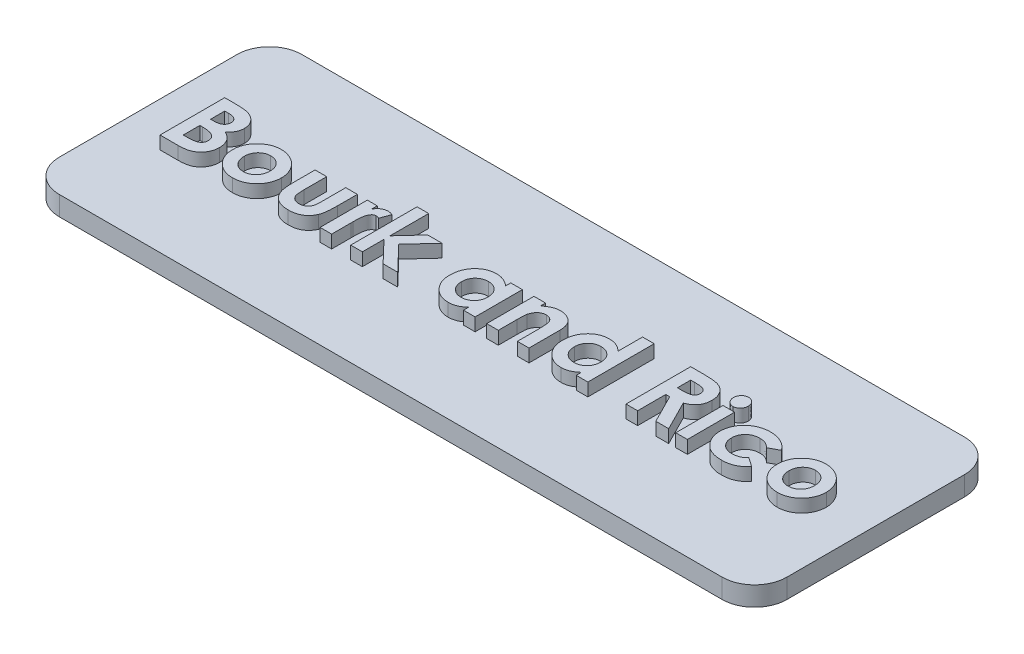
from build123d import *

# Parameters (mm, degrees)
SKETCH1_W           = 45
SKETCH1_H           = 15
BOSS_EXTRUDE1_DEPTH = 1.2
SKETCH2_W           = 0.717948718
SKETCH2_H           = 2.923076923
BOSS_EXTRUDE2_DEPTH = 0.8
FILLET1_R           = 2


with BuildPart() as part:
    # Sketch1 → Boss-Extrude1 (new body)
    with BuildSketch(Plane(origin=(0, 0, 0), x_dir=(1, 0, 0), z_dir=(0, 1, 0))):
        with Locations((22.5, 0)):
            Rectangle(SKETCH1_W, SKETCH1_H)
    extrude(amount=BOSS_EXTRUDE1_DEPTH)

    # Sketch2 → Boss-Extrude2 (add)
    # profile 1 of 13: a face of its own
    with BuildSketch(Plane(origin=(0, 1.2, 0), x_dir=(1, 0, 0), z_dir=(0, 1, 0))):
        with BuildLine():
            Line((2.730769231, -2), (2.730769231, 2))
            Line((2.730769231, 2), (3.371794872, 2))
            add(Edge.make_bspline(
                [(3.371794872, 2), (3.416670675, 2.000005121), (3.503504503, 2.000015031), (3.628783055, 1.99561566), (3.744968332, 1.98992458), (3.851690588, 1.983557585), (3.94913147, 1.972585981), (4.037142805, 1.961023108), (4.115900439, 1.947078997), (4.164592005, 1.934570697), (4.1875, 1.928685897)],
                knots=[0, 0, 0, 0, 1.311965854, 2.538629056, 3.664479157, 4.713267157, 5.663616078, 6.530575999, 7.308677837, 8, 8, 8, 8], degree=3))
            add(Edge.make_bspline(
                [(4.1875, 1.928685897), (4.217580524, 1.920385283), (4.276608168, 1.904096814), (4.361154593, 1.871201546), (4.441358669, 1.834636124), (4.517122472, 1.792921815), (4.58798078, 1.745555013), (4.653664309, 1.692159799), (4.715589689, 1.634879455), (4.771558091, 1.572117594), (4.822144305, 1.505798061), (4.866094655, 1.435938236), (4.904281877, 1.363606319), (4.934841656, 1.287892062), (4.957867876, 1.209144149), (4.974709157, 1.127698846), (4.985624588, 1.04329844), (4.986655953, 0.985878085), (4.987179487, 0.956730769)],
                knots=[0, 0, 0, 0, 1.099996261, 2.158545794, 3.195537121, 4.207578794, 5.205712374, 6.197378256, 7.190519799, 8.17788031, 9.159561366, 10.129234751, 11.085776129, 12.040971148, 13.00380137, 13.975669004, 14.972423361, 16, 16, 16, 16], degree=3))
            add(Edge.make_bspline(
                [(4.987179487, 0.956730769), (4.985810601, 0.919284119), (4.983116116, 0.845574989), (4.965903562, 0.737309612), (4.933627343, 0.63498327), (4.891394695, 0.536710127), (4.833971497, 0.442856741), (4.761055142, 0.353467738), (4.673826636, 0.265790696), (4.606917556, 0.213234224), (4.572115385, 0.185897436)],
                knots=[0, 0, 0, 0, 0.986156485, 1.941127874, 2.875419072, 3.804401753, 4.751181392, 5.761612777, 6.835722519, 8, 8, 8, 8], degree=3))
            add(Edge.make_bspline(
                [(4.572115385, 0.185897436), (4.600317394, 0.171500554), (4.655613733, 0.143272253), (4.734118289, 0.096873352), (4.806804938, 0.047522237), (4.873999586, -0.00378813), (4.934292747, -0.059232867), (4.990174028, -0.115617174), (5.038886536, -0.176171636), (5.082446729, -0.238737978), (5.12030854, -0.304222167), (5.153282003, -0.372513615), (5.181133505, -0.443845621), (5.204718876, -0.517855162), (5.222308853, -0.594796797), (5.233777892, -0.674698043), (5.242559304, -0.757286397), (5.243242416, -0.813543521), (5.243589744, -0.842147436)],
                knots=[0, 0, 0, 0, 1.164658916, 2.283573913, 3.35186032, 4.395461096, 5.390182219, 6.362969632, 7.312859996, 8.245001507, 9.165155236, 10.092416118, 11.032087915, 11.979892451, 12.947605196, 13.931445124, 14.948243989, 16, 16, 16, 16], degree=3))
            add(Edge.make_bspline(
                [(5.243589744, -0.842147436), (5.241335819, -0.896779278), (5.236887707, -1.004595001), (5.204365283, -1.162893242), (5.147981734, -1.312974333), (5.072270255, -1.454241786), (4.978979145, -1.582606141), (4.871721122, -1.695052202), (4.751576027, -1.790235296), (4.640727656, -1.8544765), (4.544852544, -1.897588356), (4.46544098, -1.924242823), (4.380154644, -1.948935482), (4.287431294, -1.966275177), (4.18895188, -1.982146372), (4.083756219, -1.991945577), (3.972040921, -1.998586256), (3.895310025, -1.999519225), (3.855769231, -2)],
                knots=[0, 0, 0, 0, 1.284142165, 2.534249414, 3.780121997, 5.041676246, 6.291546858, 7.49970053, 8.684500223, 9.883330709, 10.50184324, 11.153274765, 11.851151195, 12.587658647, 13.369265475, 14.195992086, 15.070362669, 16, 16, 16, 16], degree=3))
            Line((3.855769231, -2), (2.730769231, -2))
        make_face()
        with BuildLine():
            Line((3.448717949, 1.282051282), (3.448717949, 0.41025641))
            Line((3.448717949, 0.41025641), (3.639423077, 0.41025641))
            add(Edge.make_bspline(
                [(3.639423077, 0.41025641), (3.665341617, 0.41048243), (3.715375791, 0.410918747), (3.787644847, 0.416538357), (3.854843399, 0.426125762), (3.916716576, 0.439502603), (3.973840749, 0.456489241), (4.025850993, 0.476927824), (4.072518629, 0.501865118), (4.126735627, 0.539010317), (4.184046905, 0.593671141), (4.234497378, 0.672640026), (4.26421237, 0.763453943), (4.267521818, 0.827502949), (4.269230769, 0.860576923)],
                knots=[0, 0, 0, 0, 1.065314748, 2.056525647, 2.977365736, 3.853934255, 4.656397591, 5.425096493, 6.14721249, 6.826394842, 8.123232004, 9.372140726, 10.643011755, 12, 12, 12, 12], degree=3))
            add(Edge.make_bspline(
                [(4.269230769, 0.860576923), (4.267863296, 0.891556195), (4.26521934, 0.951453371), (4.235300164, 1.035554342), (4.188829768, 1.110085014), (4.133964935, 1.161095164), (4.082299033, 1.195933593), (4.038059518, 1.218873214), (3.989503327, 1.239408529), (3.935690466, 1.255110331), (3.876928236, 1.266892411), (3.813502076, 1.275544937), (3.745302557, 1.281434215), (3.698197003, 1.281841181), (3.673878205, 1.282051282)],
                knots=[0, 0, 0, 0, 1.347982417, 2.606269829, 3.849316587, 5.153353503, 5.842674298, 6.568177932, 7.326619318, 8.142485038, 9.012069166, 9.942760135, 10.937925643, 12, 12, 12, 12], degree=3))
            Line((3.673878205, 1.282051282), (3.448717949, 1.282051282))
        make_face(mode=Mode.SUBTRACT)
        with BuildLine():
            Line((3.448717949, -0.256410256), (3.448717949, -1.282051282))
            Line((3.448717949, -1.282051282), (3.655448718, -1.282051282))
            add(Edge.make_bspline(
                [(3.655448718, -1.282051282), (3.696319654, -1.281817788), (3.774899129, -1.281368866), (3.887464088, -1.275944826), (3.989813777, -1.266168948), (4.081677008, -1.253964552), (4.163194486, -1.237429504), (4.234090664, -1.216407311), (4.295337791, -1.193279236), (4.346568625, -1.164713318), (4.388421281, -1.131469672), (4.426188916, -1.097493869), (4.456982291, -1.058299569), (4.481346585, -1.015569276), (4.502433838, -0.970364441), (4.51515218, -0.920919832), (4.524835479, -0.868700869), (4.525368377, -0.832582141), (4.525641026, -0.814102564)],
                knots=[0, 0, 0, 0, 1.753078804, 3.370512758, 4.83203934, 6.162291463, 7.344201807, 8.395507345, 9.331626367, 10.147333109, 10.898971645, 11.62040215, 12.321813352, 13.025280112, 13.727906689, 14.453419512, 15.208716525, 16, 16, 16, 16], degree=3))
            add(Edge.make_bspline(
                [(4.525641026, -0.814102564), (4.525039757, -0.792970878), (4.523868647, -0.751812037), (4.514304178, -0.691653999), (4.496922415, -0.635492479), (4.475029235, -0.581891351), (4.444563712, -0.532769723), (4.40835648, -0.48642768), (4.3646089, -0.444434508), (4.315412194, -0.404250303), (4.258029107, -0.369066854), (4.192432718, -0.338538981), (4.118266669, -0.313043224), (4.035301225, -0.292743487), (3.943900099, -0.27551538), (3.843396164, -0.265228298), (3.734626451, -0.257577344), (3.659203762, -0.256808125), (3.620192308, -0.256410256)],
                knots=[0, 0, 0, 0, 0.845221588, 1.646264278, 2.427170338, 3.19324141, 3.95557735, 4.731569926, 5.540061037, 6.376114724, 7.268642756, 8.224665384, 9.265483498, 10.400594375, 11.639216012, 12.983232105, 14.439614077, 16, 16, 16, 16], degree=3))
            Line((3.620192308, -0.256410256), (3.448717949, -0.256410256))
        make_face(mode=Mode.SUBTRACT)
    # profile 2 of 13: a face of its own
    with BuildSketch(Plane(origin=(0, 1.2, 0), x_dir=(1, 0, 0), z_dir=(0, 1, 0))):
        with BuildLine():
            add(Edge.make_bspline(
                [(7.251602564, 0.974358974), (7.285545793, 0.973754931), (7.352768768, 0.972558653), (7.452888991, 0.962600724), (7.551258881, 0.946353952), (7.648443856, 0.925317219), (7.743541463, 0.89584161), (7.837050476, 0.860490174), (7.929806986, 0.819902591), (8.019508793, 0.771589171), (8.106803928, 0.719188861), (8.18956491, 0.66138702), (8.267104468, 0.598637661), (8.340862, 0.532395677), (8.407400284, 0.45977711), (8.470971476, 0.384281025), (8.528140978, 0.303202662), (8.581071702, 0.218517714), (8.628195545, 0.130715895), (8.669113936, 0.040407988), (8.704627252, -0.051157438), (8.732433466, -0.145095711), (8.755454449, -0.240168131), (8.769982326, -0.337539739), (8.780310639, -0.436210284), (8.78146877, -0.502643415), (8.782051282, -0.536057692)],
                knots=[0, 0, 0, 0, 1.022364134, 2.024744242, 3.027414945, 4.024939316, 5.017584196, 6.023349371, 7.035562955, 8.064994934, 9.090267829, 10.101425541, 11.102933353, 12.093946398, 13.084502048, 14.067315274, 15.065326281, 16.070028806, 17.074376865, 18.064572984, 19.055292013, 20.030201733, 21.013838017, 21.999348303, 22.993720005, 24, 24, 24, 24], degree=3))
            add(Edge.make_bspline(
                [(8.782051282, -0.536057692), (8.781436537, -0.569733019), (8.780214284, -0.636687201), (8.770355991, -0.736285865), (8.754047032, -0.834115367), (8.732929559, -0.930752036), (8.703564256, -1.024959315), (8.669254033, -1.118125856), (8.627136885, -1.208981763), (8.580573275, -1.29851819), (8.527302229, -1.384100353), (8.470182213, -1.465990926), (8.406877289, -1.542041533), (8.340871661, -1.614610716), (8.269034534, -1.681244511), (8.192512563, -1.743024871), (8.111968215, -1.80070709), (8.02682229, -1.852937834), (7.938165368, -1.898831126), (7.847492629, -1.940207674), (7.75427387, -1.974656605), (7.658702012, -2.002748759), (7.560719094, -2.024499811), (7.460541438, -2.03927556), (7.358384788, -2.049551922), (7.28955566, -2.050701629), (7.254807692, -2.051282051)],
                knots=[0, 0, 0, 0, 1.012026251, 2.012137606, 3.004615893, 3.992048833, 4.982446996, 5.968083444, 6.973977695, 7.990229942, 8.999482246, 10.001782172, 10.988562221, 11.971415814, 12.948383116, 13.930088534, 14.925840678, 15.924049238, 16.929462851, 17.924729459, 18.917889337, 19.913673841, 20.916777188, 21.931792057, 22.95587778, 24, 24, 24, 24], degree=3))
            add(Edge.make_bspline(
                [(7.254807692, -2.051282051), (7.203999079, -2.049790718), (7.103854527, -2.046851278), (6.95636528, -2.026716883), (6.8146768, -1.99206031), (6.678558208, -1.943749811), (6.547832683, -1.881841706), (6.423641092, -1.805221026), (6.304748068, -1.715396212), (6.193212927, -1.61312647), (6.091031629, -1.500927303), (6.001763971, -1.381155375), (5.925968505, -1.255605867), (5.863713425, -1.12413561), (5.815665198, -0.986564323), (5.78096618, -0.843303296), (5.760807168, -0.693949843), (5.757892589, -0.592474798), (5.756410256, -0.540865385)],
                knots=[0, 0, 0, 0, 1.029999031, 2.030143771, 3.011211297, 3.982305373, 4.953580601, 5.938004764, 6.935448627, 7.970290061, 9.001484052, 10.007591832, 10.993831261, 11.969999897, 12.951306496, 13.942897864, 14.953773953, 16, 16, 16, 16], degree=3))
            add(Edge.make_bspline(
                [(5.756410256, -0.540865385), (5.757944282, -0.485757844), (5.760959379, -0.377445077), (5.784900573, -0.218764406), (5.823132077, -0.066835183), (5.878010993, 0.077917598), (5.948113982, 0.215760912), (6.033693844, 0.346404033), (6.13517352, 0.469876554), (6.212886631, 0.544556967), (6.252403846, 0.582532051)],
                knots=[0, 0, 0, 0, 1.043912699, 2.05178951, 3.033892, 4.007821512, 4.978932272, 5.95884105, 6.962068106, 8, 8, 8, 8], degree=3))
            add(Edge.make_bspline(
                [(6.252403846, 0.582532051), (6.288664841, 0.614009125), (6.360200277, 0.676106874), (6.476421816, 0.754867689), (6.595419558, 0.822893004), (6.718619741, 0.878822465), (6.846365816, 0.920992377), (6.978003157, 0.951688299), (7.113504392, 0.970542634), (7.205335907, 0.973080396), (7.251602564, 0.974358974)],
                knots=[0, 0, 0, 0, 1.048115528, 2.067714963, 3.060638214, 4.039924844, 5.017819947, 5.994373833, 6.98952318, 8, 8, 8, 8], degree=3))
        make_face()
        with BuildLine():
            add(Edge.make_bspline(
                [(7.267628205, 0.307692308), (7.239831201, 0.306768427), (7.185112499, 0.304949759), (7.104565132, 0.295189451), (7.028382584, 0.275184863), (6.955051728, 0.249744501), (6.885869794, 0.215721601), (6.818942134, 0.175906968), (6.757748841, 0.126083854), (6.699328574, 0.071431543), (6.646295994, 0.010741618), (6.6011072, -0.055380009), (6.560730011, -0.124403665), (6.530114036, -0.19885639), (6.504776391, -0.276703177), (6.487628176, -0.359201791), (6.475694216, -0.44543068), (6.474808288, -0.504498059), (6.474358974, -0.534455128)],
                knots=[0, 0, 0, 0, 1.030650113, 2.02884584, 2.99876339, 3.944280128, 4.900564847, 5.851248946, 6.823638398, 7.81794922, 8.81432732, 9.802856497, 10.78262424, 11.771747962, 12.779760563, 13.812642396, 14.89064281, 16, 16, 16, 16], degree=3))
            add(Edge.make_bspline(
                [(6.474358974, -0.534455128), (6.474884733, -0.565468634), (6.475912226, -0.626078575), (6.486552137, -0.71457724), (6.504097701, -0.798561887), (6.529024448, -0.877902776), (6.560374042, -0.953169409), (6.598836358, -1.023939487), (6.644817323, -1.089787498), (6.696948577, -1.150632354), (6.754030074, -1.205861904), (6.816575515, -1.253257836), (6.881965734, -1.294438611), (6.951707676, -1.32751313), (7.024810805, -1.353049342), (7.101492135, -1.371850795), (7.182154625, -1.381980107), (7.237153695, -1.38372488), (7.265224359, -1.384615385)],
                knots=[0, 0, 0, 0, 1.141730614, 2.231293227, 3.276944405, 4.297399982, 5.28939179, 6.275415646, 7.257752684, 8.24146775, 9.222424823, 10.176631434, 11.126518621, 12.063689483, 13.012557477, 13.974037417, 14.965980454, 16, 16, 16, 16], degree=3))
            add(Edge.make_bspline(
                [(7.265224359, -1.384615385), (7.293309062, -1.383825547), (7.348371384, -1.382277007), (7.429128597, -1.37068089), (7.506201518, -1.352430887), (7.579929005, -1.326674894), (7.649714964, -1.292892433), (7.715826544, -1.251514643), (7.778845334, -1.203459476), (7.83669287, -1.147187849), (7.890241228, -1.08615324), (7.937199935, -1.019957622), (7.976440402, -0.949187526), (8.008624611, -0.874288237), (8.033600223, -0.795362705), (8.050855316, -0.712117573), (8.062795657, -0.624810823), (8.063661548, -0.564945658), (8.064102564, -0.534455128)],
                knots=[0, 0, 0, 0, 1.031504075, 2.022346795, 2.991027682, 3.937587355, 4.885570121, 5.833146507, 6.798790848, 7.791235734, 8.792807298, 9.778388351, 10.766749885, 11.760164525, 12.768777521, 13.802286646, 14.880660483, 16, 16, 16, 16], degree=3))
            add(Edge.make_bspline(
                [(8.064102564, -0.534455128), (8.063570118, -0.503975255), (8.062525285, -0.444163855), (8.051884616, -0.356739025), (8.034511239, -0.273762964), (8.009262992, -0.195589974), (7.978099736, -0.121328225), (7.939610835, -0.051357835), (7.893403106, 0.013976574), (7.841018427, 0.074351038), (7.783081243, 0.128805591), (7.721621741, 0.177365834), (7.655234531, 0.217528885), (7.585165078, 0.250637576), (7.511226959, 0.276109988), (7.433503183, 0.295017995), (7.351755551, 0.305003171), (7.295963731, 0.306786561), (7.267628205, 0.307692308)],
                knots=[0, 0, 0, 0, 1.123894411, 2.205445421, 3.243160173, 4.246488011, 5.231014757, 6.210004299, 7.185865357, 8.177612767, 9.153374344, 10.115157457, 11.061423229, 12.009021698, 12.96873347, 13.94135618, 14.954456845, 16, 16, 16, 16], degree=3))
        make_face(mode=Mode.SUBTRACT)
    # profile 3 of 13: a face of its own
    with BuildSketch(Plane(origin=(0, 1.2, 0), x_dir=(1, 0, 0), z_dir=(0, 1, 0))):
        with BuildLine():
            Line((9.397435897, 0.923076923), (10.115384615, 0.923076923))
            Line((10.115384615, 0.923076923), (10.115384615, -0.479967949))
            add(Edge.make_bspline(
                [(10.115384615, -0.479967949), (10.11544837, -0.512823873), (10.11557073, -0.575882415), (10.118975607, -0.666446827), (10.123753322, -0.749263835), (10.129715588, -0.824431095), (10.138614652, -0.891767805), (10.148888247, -0.951145416), (10.160535188, -1.002991753), (10.179474586, -1.060781408), (10.209105616, -1.124021071), (10.253853717, -1.191157399), (10.308056718, -1.249210693), (10.370982301, -1.298696144), (10.443273091, -1.337691767), (10.52393311, -1.364118505), (10.61194749, -1.381880021), (10.673249374, -1.383679567), (10.705128205, -1.384615385)],
                knots=[0, 0, 0, 0, 1.267339619, 2.432334223, 3.495366327, 4.467371443, 5.340232306, 6.114347373, 6.791623365, 7.387877112, 8.457231658, 9.474542289, 10.487879852, 11.508108106, 12.54995813, 13.638205937, 14.771795776, 16, 16, 16, 16], degree=3))
            add(Edge.make_bspline(
                [(10.705128205, -1.384615385), (10.736978746, -1.383547281), (10.798439167, -1.381486214), (10.887039141, -1.365413463), (10.967889146, -1.33787227), (11.041819562, -1.300515891), (11.106650178, -1.250520741), (11.163095544, -1.190947973), (11.210621218, -1.120836606), (11.233459495, -1.068535534), (11.245192308, -1.041666667)],
                knots=[0, 0, 0, 0, 1.116871431, 2.155171802, 3.144773418, 4.104381479, 5.046960687, 6.001340237, 6.973219418, 8, 8, 8, 8], degree=3))
            add(Edge.make_bspline(
                [(11.245192308, -1.041666667), (11.249497856, -1.029731275), (11.259001856, -1.003385273), (11.267460605, -0.957934796), (11.276564737, -0.904333317), (11.283766429, -0.841488482), (11.287841401, -0.769789498), (11.292207315, -0.689145997), (11.294432264, -0.599638296), (11.294720798, -0.536859829), (11.294871795, -0.50400641)],
                knots=[0, 0, 0, 0, 0.56094539, 1.238222264, 2.041156151, 2.969685991, 4.036367568, 5.220421584, 6.545382566, 8, 8, 8, 8], degree=3))
            Line((11.294871795, -0.50400641), (11.294871795, 0.923076923))
            Line((11.294871795, 0.923076923), (12.012820513, 0.923076923))
            Line((12.012820513, 0.923076923), (12.012820513, -0.305288462))
            add(Edge.make_bspline(
                [(12.012820513, -0.305288462), (12.012696201, -0.366193422), (12.012457857, -0.482966666), (12.005627065, -0.650474089), (11.996199799, -0.80277177), (11.984059293, -0.940279033), (11.966566325, -1.063052944), (11.945092774, -1.170805594), (11.921336171, -1.264249028), (11.89955048, -1.319614908), (11.889423077, -1.345352564)],
                knots=[0, 0, 0, 0, 1.388070971, 2.661352173, 3.82033814, 4.865898334, 5.806910977, 6.645039373, 7.370126333, 8, 8, 8, 8], degree=3))
            add(Edge.make_bspline(
                [(11.889423077, -1.345352564), (11.876442354, -1.373054234), (11.850819523, -1.427734949), (11.806359148, -1.505478817), (11.758428373, -1.579134972), (11.704746633, -1.646969622), (11.646409741, -1.709672196), (11.585066695, -1.768668076), (11.517954925, -1.821554862), (11.446814885, -1.869693479), (11.370653917, -1.912425723), (11.289993666, -1.950293729), (11.20396247, -1.981111793), (11.113306322, -2.007234448), (11.017607357, -2.026715457), (10.917058348, -2.041470834), (10.811549018, -2.049096469), (10.739593609, -2.050541587), (10.702724359, -2.051282051)],
                knots=[0, 0, 0, 0, 0.997311338, 1.968606903, 2.91805772, 3.860812155, 4.785445165, 5.709667791, 6.633356648, 7.568312411, 8.508286151, 9.478643871, 10.470653671, 11.485274776, 12.552984541, 13.653035246, 14.797438149, 16, 16, 16, 16], degree=3))
            add(Edge.make_bspline(
                [(10.702724359, -2.051282051), (10.662895209, -2.050807393), (10.584963068, -2.049878647), (10.471105299, -2.038505155), (10.362597314, -2.023789334), (10.260650599, -1.998769742), (10.16384142, -1.969783293), (10.073281201, -1.932788873), (9.98859989, -1.889293918), (9.909630866, -1.839556289), (9.836986583, -1.783120193), (9.769051715, -1.722425138), (9.70801949, -1.655056258), (9.651897456, -1.583093931), (9.601311966, -1.505875853), (9.556237912, -1.423676587), (9.516637115, -1.336122251), (9.495508125, -1.274759162), (9.484775641, -1.243589744)],
                knots=[0, 0, 0, 0, 1.211240017, 2.369985978, 3.478996442, 4.539426614, 5.559871561, 6.551301256, 7.510778031, 8.453136967, 9.386094087, 10.30661716, 11.221130616, 12.147659962, 13.080758632, 14.026335491, 14.997475882, 16, 16, 16, 16], degree=3))
            add(Edge.make_bspline(
                [(9.484775641, -1.243589744), (9.477453591, -1.21938238), (9.461680188, -1.167234075), (9.444649745, -1.080569679), (9.431028178, -0.98068411), (9.417777548, -0.867479117), (9.408533666, -0.740764911), (9.402491755, -0.600742731), (9.398409423, -0.447138765), (9.397769966, -0.340280605), (9.397435897, -0.284455128)],
                knots=[0, 0, 0, 0, 0.627914866, 1.352675004, 2.190563461, 3.132055958, 4.183353232, 5.345633452, 6.613289997, 8, 8, 8, 8], degree=3))
            Line((9.397435897, -0.284455128), (9.397435897, 0.923076923))
        make_face()
    # profile 4 of 13: a face of its own
    with BuildSketch(Plane(origin=(0, 1.2, 0), x_dir=(1, 0, 0), z_dir=(0, 1, 0))):
        with BuildLine():
            Line((12.628205128, 0.923076923), (13.243589744, 0.923076923))
            Line((13.243589744, 0.923076923), (13.243589744, 0.563301282))
            add(Edge.make_bspline(
                [(13.243589744, 0.563301282), (13.260997793, 0.595274642), (13.295022548, 0.657767901), (13.357528876, 0.741652726), (13.429338677, 0.812298184), (13.507871603, 0.871181892), (13.593365673, 0.917075959), (13.683531506, 0.949781268), (13.777597737, 0.971035187), (13.84176653, 0.973243068), (13.874198718, 0.974358974)],
                knots=[0, 0, 0, 0, 1.09866127, 2.147379032, 3.14564304, 4.131443017, 5.102343063, 6.064490016, 7.021754664, 8, 8, 8, 8], degree=3))
            add(Edge.make_bspline(
                [(13.874198718, 0.974358974), (13.897748533, 0.973256225), (13.945704366, 0.971010635), (14.018795803, 0.957956982), (14.092941821, 0.934353496), (14.141736291, 0.913101694), (14.166666667, 0.90224359)],
                knots=[0, 0, 0, 0, 0.931404136, 1.896671404, 2.925354185, 4, 4, 4, 4], degree=3))
            Line((14.166666667, 0.90224359), (13.943910256, 0.294070513))
            add(Edge.make_bspline(
                [(13.943910256, 0.294070513), (13.923999014, 0.303690662), (13.886573544, 0.32177284), (13.832238259, 0.343111673), (13.782926736, 0.356131585), (13.751664135, 0.35807427), (13.737179487, 0.358974359)],
                knots=[0, 0, 0, 0, 1.214386998, 2.282580073, 3.20428172, 4, 4, 4, 4], degree=3))
            add(Edge.make_bspline(
                [(13.737179487, 0.358974359), (13.723503163, 0.358377913), (13.696599476, 0.3572046), (13.656890388, 0.347149711), (13.619492695, 0.329810365), (13.582604206, 0.307596942), (13.549135013, 0.276718624), (13.515686493, 0.240971487), (13.486209866, 0.196836892), (13.455103477, 0.147712847), (13.428617498, 0.087585059), (13.405906587, 0.015804872), (13.385670983, -0.068458262), (13.371746124, -0.165651737), (13.35828719, -0.27483504), (13.350276101, -0.396809561), (13.344305336, -0.531189607), (13.343940263, -0.624991729), (13.34375, -0.673878205)],
                knots=[0, 0, 0, 0, 0.544232178, 1.070598461, 1.618251235, 2.182094276, 2.777567932, 3.425210017, 4.127676488, 4.886675562, 5.738955394, 6.734782583, 7.883056018, 9.186093582, 10.642914445, 12.264202625, 14.053029461, 16, 16, 16, 16], degree=3))
            Line((13.34375, -0.673878205), (13.346153846, -0.81650641))
            Line((13.346153846, -0.81650641), (13.346153846, -2))
            Line((13.346153846, -2), (12.628205128, -2))
            Line((12.628205128, -2), (12.628205128, 0.923076923))
        make_face()
    # profile 5 of 13: a face of its own
    with BuildSketch(Plane(origin=(0, 1.2, 0), x_dir=(1, 0, 0), z_dir=(0, 1, 0))):
        Polygon((14.525641026, 2.102564103), (15.243589744, 2.102564103), (15.243589744, -0.290064103), (16.360576923, 0.923076923), (17.247596154, 0.923076923), (15.96474359, -0.470352564), (17.431089744, -2), (16.52724359, -2), (15.243589744, -0.661057692), (15.243589744, -2), (14.525641026, -2), align=None)
    # profile 6 of 13: a face of its own
    with BuildSketch(Plane(origin=(0, 1.2, 0), x_dir=(1, 0, 0), z_dir=(0, 1, 0))):
        with BuildLine():
            Line((21.5, 0.923076923), (22.217948718, 0.923076923))
            Line((22.217948718, 0.923076923), (22.217948718, -2))
            Line((22.217948718, -2), (21.5, -2))
            Line((21.5, -2), (21.5, -1.681089744))
            add(Edge.make_bspline(
                [(21.5, -1.681089744), (21.464425906, -1.712132127), (21.395383613, -1.772379264), (21.286595302, -1.850551456), (21.177489098, -1.915033411), (21.067540744, -1.966389772), (20.95506038, -2.004311159), (20.839238191, -2.031767128), (20.718406216, -2.047958585), (20.636266304, -2.05016269), (20.594551282, -2.051282051)],
                knots=[0, 0, 0, 0, 1.129196829, 2.191548051, 3.199897424, 4.157751732, 5.089409408, 6.034969131, 7.002052659, 8, 8, 8, 8], degree=3))
            add(Edge.make_bspline(
                [(20.594551282, -2.051282051), (20.547724315, -2.050228591), (20.455191574, -2.048146894), (20.31941005, -2.026233671), (20.18829949, -1.992690601), (20.061966318, -1.945222963), (19.940640387, -1.88371421), (19.823393185, -1.809769191), (19.712234687, -1.720791994), (19.606239536, -1.620632436), (19.509191012, -1.510456209), (19.424350276, -1.391792545), (19.352835841, -1.266324425), (19.294247891, -1.134467834), (19.248160902, -0.996319548), (19.215307474, -0.851441401), (19.195923914, -0.699781652), (19.193524775, -0.59647697), (19.192307692, -0.544070513)],
                knots=[0, 0, 0, 0, 0.980476535, 1.937477201, 2.874147792, 3.812856188, 4.758993464, 5.720109578, 6.712210464, 7.737600662, 8.772720504, 9.783789959, 10.789002326, 11.793715968, 12.802552247, 13.835794126, 14.902098527, 16, 16, 16, 16], degree=3))
            add(Edge.make_bspline(
                [(19.192307692, -0.544070513), (19.193585025, -0.489803558), (19.196090656, -0.383352878), (19.214419197, -0.227141567), (19.246666356, -0.078671179), (19.290637675, 0.062263939), (19.347199141, 0.195688136), (19.416087228, 0.321820003), (19.498239094, 0.440329851), (19.592904555, 0.54920056), (19.695120002, 0.648985823), (19.804472461, 0.735856808), (19.919251897, 0.809657752), (20.039580285, 0.869907962), (20.165440441, 0.916466275), (20.29633547, 0.950504204), (20.432846454, 0.970928157), (20.525838843, 0.973205871), (20.572916667, 0.974358974)],
                knots=[0, 0, 0, 0, 1.136281865, 2.228943489, 3.287578264, 4.313574083, 5.316051562, 6.317280042, 7.318008486, 8.329309503, 9.333984563, 10.305318864, 11.248632312, 12.186624717, 13.117503092, 14.05354244, 15.014596925, 16, 16, 16, 16], degree=3))
            add(Edge.make_bspline(
                [(20.572916667, 0.974358974), (20.616525986, 0.973452982), (20.702813109, 0.971660349), (20.829642748, 0.952195784), (20.952649205, 0.922757013), (21.071161474, 0.880812063), (21.186151631, 0.827848031), (21.295641775, 0.76148015), (21.4020271, 0.684497834), (21.466938875, 0.624373014), (21.5, 0.59375)],
                knots=[0, 0, 0, 0, 1.017011718, 2.012299608, 2.98747302, 3.965332399, 4.941441765, 5.936729654, 6.94912688, 8, 8, 8, 8], degree=3))
            Line((21.5, 0.59375), (21.5, 0.923076923))
        make_face()
        with BuildLine():
            add(Edge.make_bspline(
                [(20.723557692, 0.307692308), (20.694949552, 0.306814511), (20.638879466, 0.305094087), (20.55642073, 0.294745618), (20.477614916, 0.276511154), (20.403024059, 0.24957365), (20.331536482, 0.216759845), (20.264237736, 0.175661093), (20.200572382, 0.127083243), (20.140914845, 0.072202362), (20.086528209, 0.01187824), (20.039643755, -0.053948447), (19.999799543, -0.123504045), (19.966101696, -0.196997682), (19.941981682, -0.275299015), (19.922878642, -0.357388701), (19.9129654, -0.443937371), (19.911168442, -0.502917611), (19.91025641, -0.532852564)],
                knots=[0, 0, 0, 0, 1.04836806, 2.054732945, 3.03993516, 4.00574415, 4.955904794, 5.917688631, 6.888591924, 7.88601754, 8.884115178, 9.859153345, 10.841239365, 11.818093293, 12.814750328, 13.83810466, 14.90274714, 16, 16, 16, 16], degree=3))
            add(Edge.make_bspline(
                [(19.91025641, -0.532852564), (19.911154511, -0.563059045), (19.912924207, -0.622580565), (19.923038929, -0.709859304), (19.941454564, -0.793148128), (19.96832228, -0.871773703), (20.001133994, -0.946796949), (20.041073228, -1.017871627), (20.090131582, -1.083741047), (20.144565894, -1.1459639), (20.205447296, -1.201526494), (20.269472894, -1.250860975), (20.337517226, -1.292139105), (20.408842059, -1.32550035), (20.483207311, -1.352686961), (20.561545296, -1.370692255), (20.643088595, -1.382202698), (20.698678815, -1.383805602), (20.726762821, -1.384615385)],
                knots=[0, 0, 0, 0, 1.099136573, 2.165835871, 3.191374663, 4.196217796, 5.183857741, 6.167377911, 7.154730987, 8.166690795, 9.170734848, 10.148332609, 11.103258353, 12.059567475, 13.009337315, 13.978056681, 14.978520572, 16, 16, 16, 16], degree=3))
            add(Edge.make_bspline(
                [(20.726762821, -1.384615385), (20.755903821, -1.383732667), (20.813036022, -1.382002061), (20.89684003, -1.371748032), (20.97670449, -1.35344671), (21.052297121, -1.326354982), (21.12477253, -1.293776715), (21.193476692, -1.253481065), (21.257664062, -1.205014687), (21.31765972, -1.149637682), (21.372634175, -1.088820977), (21.420167004, -1.022131077), (21.461569837, -0.951700909), (21.494131261, -0.875865245), (21.519989597, -0.795950857), (21.538542357, -0.711461779), (21.548633983, -0.62230692), (21.550388201, -0.561455255), (21.551282051, -0.530448718)],
                knots=[0, 0, 0, 0, 1.050008698, 2.058587853, 3.036635738, 3.995319155, 4.947022481, 5.895997462, 6.858296291, 7.838991643, 8.833936038, 9.806048392, 10.784806122, 11.771666913, 12.772873988, 13.80724452, 14.882696879, 16, 16, 16, 16], degree=3))
            add(Edge.make_bspline(
                [(21.551282051, -0.530448718), (21.550399308, -0.499975478), (21.548675055, -0.440452389), (21.538498835, -0.353159042), (21.519814361, -0.270328943), (21.494488231, -0.19180984), (21.46134753, -0.117781265), (21.419913371, -0.04906402), (21.37290195, 0.016722691), (21.317318848, 0.0758964), (21.2576482, 0.130872434), (21.19251685, 0.177873153), (21.123976791, 0.218379677), (21.051606909, 0.251637095), (20.974737094, 0.276016044), (20.894736152, 0.294891771), (20.810355902, 0.305087876), (20.752962578, 0.306809997), (20.723557692, 0.307692308)],
                knots=[0, 0, 0, 0, 1.106611376, 2.161533483, 3.185006901, 4.184773755, 5.152708835, 6.122342771, 7.094156588, 8.082475533, 9.064254463, 10.03606828, 10.992420271, 11.951521816, 12.920622147, 13.915721683, 14.932141191, 16, 16, 16, 16], degree=3))
        make_face(mode=Mode.SUBTRACT)
    # profile 7 of 13: a face of its own
    with BuildSketch(Plane(origin=(0, 1.2, 0), x_dir=(1, 0, 0), z_dir=(0, 1, 0))):
        with BuildLine():
            Line((22.935897436, 0.923076923), (23.653846154, 0.923076923))
            Line((23.653846154, 0.923076923), (23.653846154, 0.613782051))
            add(Edge.make_bspline(
                [(23.653846154, 0.613782051), (23.694804772, 0.645640508), (23.773084654, 0.706528213), (23.892083591, 0.784160346), (24.004403853, 0.84769913), (24.112549181, 0.896029981), (24.218554331, 0.93080195), (24.324136134, 0.955783535), (24.430866915, 0.97177993), (24.502615908, 0.973499754), (24.538461538, 0.974358974)],
                knots=[0, 0, 0, 0, 1.276643801, 2.439914479, 3.493451431, 4.44993799, 5.350072675, 6.235028322, 7.118224225, 8, 8, 8, 8], degree=3))
            add(Edge.make_bspline(
                [(24.538461538, 0.974358974), (24.574822107, 0.973377064), (24.646200958, 0.971449491), (24.751302382, 0.957967679), (24.851716585, 0.933413028), (24.948572643, 0.900811094), (25.040884727, 0.85777841), (25.129783716, 0.80668408), (25.213360092, 0.744447729), (25.264830123, 0.697051512), (25.290865385, 0.673076923)],
                knots=[0, 0, 0, 0, 1.048836932, 2.058954983, 3.049370783, 4.026390553, 5.001981509, 5.982488534, 6.97947532, 8, 8, 8, 8], degree=3))
            add(Edge.make_bspline(
                [(25.290865385, 0.673076923), (25.311746622, 0.650859489), (25.353661924, 0.606262017), (25.406407064, 0.529944319), (25.451668328, 0.446744059), (25.488753644, 0.355701496), (25.516158198, 0.256316408), (25.537240896, 0.149789228), (25.549070766, 0.035523479), (25.550531219, -0.042976012), (25.551282051, -0.083333333)],
                knots=[0, 0, 0, 0, 0.889584746, 1.785680191, 2.700364693, 3.65222533, 4.649950538, 5.707241244, 6.821271309, 8, 8, 8, 8], degree=3))
            Line((25.551282051, -0.083333333), (25.551282051, -2))
            Line((25.551282051, -2), (24.833333333, -2))
            Line((24.833333333, -2), (24.833333333, -0.730769231))
            add(Edge.make_bspline(
                [(24.833333333, -0.730769231), (24.833181503, -0.689369134), (24.832890548, -0.610033533), (24.830656661, -0.496492365), (24.826294811, -0.393949946), (24.822319099, -0.302219575), (24.814513195, -0.221626957), (24.807473705, -0.151661878), (24.79667229, -0.092959068), (24.782617896, -0.029815388), (24.758075463, 0.037791468), (24.719974533, 0.10902646), (24.67163816, 0.169542174), (24.615040596, 0.219762855), (24.550244346, 0.25949202), (24.47803238, 0.287443963), (24.39879184, 0.304864299), (24.343577962, 0.306725654), (24.314903846, 0.307692308)],
                knots=[0, 0, 0, 0, 1.49886392, 2.872294502, 4.110984203, 5.214877267, 6.195405875, 7.042225351, 7.75923308, 8.355011229, 9.382752534, 10.352059385, 11.267231453, 12.171456522, 13.078624015, 14.003401117, 14.963110155, 16, 16, 16, 16], degree=3))
            add(Edge.make_bspline(
                [(24.314903846, 0.307692308), (24.277611952, 0.305801226), (24.204661757, 0.302101902), (24.099153894, 0.274205625), (24.00224668, 0.226762269), (23.914731926, 0.161110204), (23.837443137, 0.080054595), (23.77378604, -0.016613517), (23.721574144, -0.126561052), (23.699122252, -0.206840612), (23.6875, -0.248397436)],
                knots=[0, 0, 0, 0, 0.984188326, 1.925263693, 2.85911992, 3.81709677, 4.80007086, 5.801799564, 6.862098548, 8, 8, 8, 8], degree=3))
            add(Edge.make_bspline(
                [(23.6875, -0.248397436), (23.684611409, -0.261448635), (23.678169269, -0.290555432), (23.672871424, -0.339728185), (23.665501737, -0.398066896), (23.662740497, -0.46662733), (23.657939003, -0.545085021), (23.656163182, -0.633543765), (23.654384182, -0.73183011), (23.654031438, -0.800479387), (23.653846154, -0.836538462)],
                knots=[0, 0, 0, 0, 0.543362196, 1.211806945, 2.009705693, 2.934833164, 4.000995085, 5.207458376, 6.533175157, 8, 8, 8, 8], degree=3))
            Line((23.653846154, -0.836538462), (23.653846154, -2))
            Line((23.653846154, -2), (22.935897436, -2))
            Line((22.935897436, -2), (22.935897436, 0.923076923))
        make_face()
    # profile 8 of 13: a face of its own
    with BuildSketch(Plane(origin=(0, 1.2, 0), x_dir=(1, 0, 0), z_dir=(0, 1, 0))):
        with BuildLine():
            Line((28.474358974, 2.102564103), (29.192307692, 2.102564103))
            Line((29.192307692, 2.102564103), (29.192307692, -2))
            Line((29.192307692, -2), (28.474358974, -2))
            Line((28.474358974, -2), (28.474358974, -1.681089744))
            add(Edge.make_bspline(
                [(28.474358974, -1.681089744), (28.43878488, -1.712132127), (28.369742588, -1.772379264), (28.260954276, -1.850551456), (28.151848072, -1.915033411), (28.041899718, -1.966389772), (27.929419354, -2.004311159), (27.813597166, -2.031767128), (27.692765191, -2.047958585), (27.610625279, -2.05016269), (27.568910256, -2.051282051)],
                knots=[0, 0, 0, 0, 1.129196829, 2.191548051, 3.199897424, 4.157751732, 5.089409408, 6.034969131, 7.002052659, 8, 8, 8, 8], degree=3))
            add(Edge.make_bspline(
                [(27.568910256, -2.051282051), (27.522083289, -2.050228591), (27.429550549, -2.048146894), (27.293769025, -2.026233671), (27.162658464, -1.992690601), (27.036325292, -1.945222963), (26.914999361, -1.88371421), (26.79775216, -1.809769191), (26.686593662, -1.720791994), (26.580598511, -1.620632436), (26.483549986, -1.510456209), (26.39870925, -1.391792545), (26.327194815, -1.266324425), (26.268606865, -1.134467834), (26.222519877, -0.996319548), (26.189666449, -0.851441401), (26.170282888, -0.699781652), (26.167883749, -0.59647697), (26.166666667, -0.544070513)],
                knots=[0, 0, 0, 0, 0.980476535, 1.937477201, 2.874147792, 3.812856188, 4.758993464, 5.720109578, 6.712210464, 7.737600662, 8.772720504, 9.783789959, 10.789002326, 11.793715968, 12.802552247, 13.835794126, 14.902098527, 16, 16, 16, 16], degree=3))
            add(Edge.make_bspline(
                [(26.166666667, -0.544070513), (26.167944, -0.489803558), (26.170449631, -0.383352878), (26.188778171, -0.227141567), (26.22102533, -0.078671179), (26.264996649, 0.062263939), (26.321558116, 0.195688136), (26.390446203, 0.321820003), (26.472598068, 0.440329851), (26.567263529, 0.54920056), (26.669478977, 0.648985823), (26.778831435, 0.735856808), (26.893610872, 0.809657752), (27.01393926, 0.869907962), (27.139799415, 0.916466275), (27.270694444, 0.950504204), (27.407205428, 0.970928157), (27.500197817, 0.973205871), (27.547275641, 0.974358974)],
                knots=[0, 0, 0, 0, 1.136281865, 2.228943489, 3.287578264, 4.313574083, 5.316051562, 6.317280042, 7.318008486, 8.329309503, 9.333984563, 10.305318864, 11.248632312, 12.186624717, 13.117503092, 14.05354244, 15.014596925, 16, 16, 16, 16], degree=3))
            add(Edge.make_bspline(
                [(27.547275641, 0.974358974), (27.590856846, 0.972976281), (27.67703868, 0.970242004), (27.804344094, 0.953030416), (27.92683608, 0.920622498), (28.046002299, 0.878867277), (28.160295149, 0.822678992), (28.270328674, 0.75518341), (28.376392796, 0.675523355), (28.44129075, 0.613921019), (28.474358974, 0.582532051)],
                knots=[0, 0, 0, 0, 1.011899165, 2.001030639, 2.974036179, 3.948778736, 4.92769327, 5.924124564, 6.942254589, 8, 8, 8, 8], degree=3))
            Line((28.474358974, 0.582532051), (28.474358974, 2.102564103))
        make_face()
        with BuildLine():
            add(Edge.make_bspline(
                [(27.697916667, 0.307692308), (27.669308527, 0.306814511), (27.61323844, 0.305094087), (27.530779705, 0.294745618), (27.45197389, 0.276511154), (27.377383033, 0.24957365), (27.305895457, 0.216759845), (27.23859671, 0.175661093), (27.174931357, 0.127083243), (27.115273819, 0.072202362), (27.060887183, 0.01187824), (27.014002729, -0.053948447), (26.974158518, -0.123504045), (26.94046067, -0.196997682), (26.916340657, -0.275299015), (26.897237616, -0.357388701), (26.887324375, -0.443937371), (26.885527416, -0.502917611), (26.884615385, -0.532852564)],
                knots=[0, 0, 0, 0, 1.04836806, 2.054732945, 3.03993516, 4.00574415, 4.955904794, 5.917688631, 6.888591924, 7.88601754, 8.884115178, 9.859153345, 10.841239365, 11.818093293, 12.814750328, 13.83810466, 14.90274714, 16, 16, 16, 16], degree=3))
            add(Edge.make_bspline(
                [(26.884615385, -0.532852564), (26.885513485, -0.563059045), (26.887283181, -0.622580565), (26.897397904, -0.709859304), (26.915813538, -0.793148128), (26.942681254, -0.871773703), (26.975492968, -0.946796949), (27.015432202, -1.017871627), (27.064490557, -1.083741047), (27.118924868, -1.1459639), (27.179806271, -1.201526494), (27.243831868, -1.250860975), (27.3118762, -1.292139105), (27.383201033, -1.32550035), (27.457566285, -1.352686961), (27.53590427, -1.370692255), (27.617447569, -1.382202698), (27.67303779, -1.383805602), (27.701121795, -1.384615385)],
                knots=[0, 0, 0, 0, 1.099136573, 2.165835871, 3.191374663, 4.196217796, 5.183857741, 6.167377911, 7.154730987, 8.166690795, 9.170734848, 10.148332609, 11.103258353, 12.059567475, 13.009337315, 13.978056681, 14.978520572, 16, 16, 16, 16], degree=3))
            add(Edge.make_bspline(
                [(27.701121795, -1.384615385), (27.730262795, -1.383732667), (27.787394997, -1.382002061), (27.871199005, -1.371748032), (27.951063464, -1.35344671), (28.026656095, -1.326354982), (28.099131505, -1.293776715), (28.167835666, -1.253481065), (28.232023036, -1.205014687), (28.292018694, -1.149637682), (28.34699315, -1.088820977), (28.394525979, -1.022131077), (28.435928812, -0.951700909), (28.468490235, -0.875865245), (28.494348572, -0.795950857), (28.512901331, -0.711461779), (28.522992957, -0.62230692), (28.524747176, -0.561455255), (28.525641026, -0.530448718)],
                knots=[0, 0, 0, 0, 1.050008698, 2.058587853, 3.036635738, 3.995319155, 4.947022481, 5.895997462, 6.858296291, 7.838991643, 8.833936038, 9.806048392, 10.784806122, 11.771666913, 12.772873988, 13.80724452, 14.882696879, 16, 16, 16, 16], degree=3))
            add(Edge.make_bspline(
                [(28.525641026, -0.530448718), (28.524758283, -0.499975478), (28.52303403, -0.440452389), (28.512857809, -0.353159042), (28.494173335, -0.270328943), (28.468847206, -0.19180984), (28.435706505, -0.117781265), (28.394272345, -0.04906402), (28.347260924, 0.016722691), (28.291677822, 0.0758964), (28.232007174, 0.130872434), (28.166875825, 0.177873153), (28.098335765, 0.218379677), (28.025965884, 0.251637095), (27.949096069, 0.276016044), (27.869095126, 0.294891771), (27.784714876, 0.305087876), (27.727321553, 0.306809997), (27.697916667, 0.307692308)],
                knots=[0, 0, 0, 0, 1.106611376, 2.161533483, 3.185006901, 4.184773755, 5.152708835, 6.122342771, 7.094156588, 8.082475533, 9.064254463, 10.03606828, 10.992420271, 11.951521816, 12.920622147, 13.915721683, 14.932141191, 16, 16, 16, 16], degree=3))
        make_face(mode=Mode.SUBTRACT)
    # profile 9 of 13: a face of its own
    with BuildSketch(Plane(origin=(0, 1.2, 0), x_dir=(1, 0, 0), z_dir=(0, 1, 0))):
        with BuildLine():
            Line((31.551282051, 2), (32.387820513, 2))
            add(Edge.make_bspline(
                [(32.387820513, 2), (32.44311545, 1.999803735), (32.549463191, 1.999426261), (32.702810825, 1.99347073), (32.843681715, 1.98518312), (32.972284435, 1.972536007), (33.088563964, 1.955767463), (33.192636843, 1.936000125), (33.284500029, 1.913471005), (33.364928263, 1.885397945), (33.437510766, 1.853731958), (33.50516775, 1.817347159), (33.569391829, 1.776648703), (33.629753733, 1.730565704), (33.686778022, 1.679927184), (33.740572276, 1.62468217), (33.790376332, 1.564362208), (33.835881801, 1.499348442), (33.877356373, 1.430955452), (33.914011195, 1.359089332), (33.943818958, 1.283700105), (33.970157312, 1.205877309), (33.989127975, 1.124508451), (34.002321794, 1.04038567), (34.011981792, 0.953212846), (34.012537195, 0.893991499), (34.012820513, 0.863782051)],
                knots=[0, 0, 0, 0, 1.749336639, 3.364467119, 4.854658419, 6.213483162, 7.451590619, 8.570285859, 9.5643256, 10.440900261, 11.26203566, 12.067320669, 12.869050712, 13.665104639, 14.467235401, 15.27997916, 16.102287765, 16.939272006, 17.78853747, 18.631303466, 19.488103222, 20.351255419, 21.228522269, 22.127379805, 23.044756219, 24, 24, 24, 24], degree=3))
            add(Edge.make_bspline(
                [(34.012820513, 0.863782051), (34.012084556, 0.832250327), (34.010641479, 0.770422363), (34.002868281, 0.679602127), (33.988661316, 0.592711677), (33.967142801, 0.510005419), (33.942410063, 0.430453976), (33.909521866, 0.355525123), (33.872404285, 0.284129127), (33.828320818, 0.217275913), (33.779941368, 0.153480536), (33.723677084, 0.095187235), (33.663173029, 0.039262965), (33.595028049, -0.010789368), (33.522246038, -0.05835412), (33.443380895, -0.101460453), (33.35894732, -0.14119196), (33.299586335, -0.163348993), (33.269230769, -0.174679487)],
                knots=[0, 0, 0, 0, 1.099860209, 2.156625411, 3.176576793, 4.16617041, 5.135385252, 6.078461593, 7.016046972, 7.938469504, 8.868247731, 9.803980173, 10.76021508, 11.73834243, 12.748633912, 13.790971185, 14.870363756, 16, 16, 16, 16], degree=3))
            Line((33.269230769, -0.174679487), (34.192307692, -2))
            Line((34.192307692, -2), (33.394230769, -2))
            Line((33.394230769, -2), (32.512820513, -0.256410256))
            Line((32.512820513, -0.256410256), (32.269230769, -0.256410256))
            Line((32.269230769, -0.256410256), (32.269230769, -2))
            Line((32.269230769, -2), (31.551282051, -2))
            Line((31.551282051, -2), (31.551282051, 2))
        make_face()
        with BuildLine():
            Line((32.269230769, 0.461538462), (32.548878205, 0.461538462))
            add(Edge.make_bspline(
                [(32.548878205, 0.461538462), (32.583067429, 0.461923524), (32.648532446, 0.462660835), (32.742679738, 0.466080789), (32.828187933, 0.474321188), (32.90542423, 0.484732625), (32.974777277, 0.496754132), (33.035628468, 0.513981682), (33.088915427, 0.532441438), (33.134006703, 0.555382126), (33.172531652, 0.581470664), (33.205795481, 0.611107892), (33.233309436, 0.645409209), (33.255954825, 0.683442454), (33.273570475, 0.725544021), (33.28642855, 0.771251731), (33.293614313, 0.821086253), (33.294441059, 0.855478859), (33.294871795, 0.873397436)],
                knots=[0, 0, 0, 0, 1.688639943, 3.233382647, 4.650958383, 5.928841754, 7.082724185, 8.122798841, 9.049171256, 9.863274652, 10.613301712, 11.341792392, 12.054588806, 12.776240173, 13.521029143, 14.301969904, 15.115324896, 16, 16, 16, 16], degree=3))
            add(Edge.make_bspline(
                [(33.294871795, 0.873397436), (33.29405745, 0.89459642), (33.29245782, 0.936237896), (33.27658452, 0.99618702), (33.251317655, 1.051674036), (33.216683704, 1.10244824), (33.173066745, 1.146960412), (33.123012843, 1.186198246), (33.065441715, 1.217224589), (33.012135183, 1.237689235), (32.963638698, 1.249933444), (32.919872151, 1.25905772), (32.869190226, 1.265524356), (32.811554661, 1.272383375), (32.74711237, 1.276831102), (32.675512106, 1.280077055), (32.596959503, 1.281405135), (32.542200878, 1.281829698), (32.513621795, 1.282051282)],
                knots=[0, 0, 0, 0, 1.020303359, 2.004196876, 2.966617323, 3.9489082, 4.950758222, 5.960522915, 7.003732012, 8.091992268, 8.70421221, 9.413913587, 10.24622431, 11.166358409, 12.212345909, 13.359657661, 14.621978493, 16, 16, 16, 16], degree=3))
            Line((32.513621795, 1.282051282), (32.269230769, 1.282051282))
            Line((32.269230769, 1.282051282), (32.269230769, 0.461538462))
        make_face(mode=Mode.SUBTRACT)
    # profile 10 of 13: a face of its own
    with BuildSketch(Plane(origin=(0, 1.2, 0), x_dir=(1, 0, 0), z_dir=(0, 1, 0))):
        with BuildLine():
            add(Edge.make_bspline(
                [(34.985576923, 2.153846154), (35.016520508, 2.152327944), (35.077281218, 2.149346794), (35.164329203, 2.120287209), (35.244221612, 2.074679059), (35.314848716, 2.012103591), (35.373589738, 1.937377035), (35.41847006, 1.853715689), (35.443471018, 1.761021611), (35.446943281, 1.696989512), (35.448717949, 1.664262821)],
                knots=[0, 0, 0, 0, 0.989868614, 1.943702388, 2.910836514, 3.924849579, 4.949916355, 5.946401046, 6.950409252, 8, 8, 8, 8], degree=3))
            add(Edge.make_bspline(
                [(35.448717949, 1.664262821), (35.447006776, 1.631777307), (35.443672474, 1.568477737), (35.417894648, 1.477042024), (35.374815666, 1.393421312), (35.315598879, 1.319804585), (35.245737464, 1.258236931), (35.167590765, 1.211800793), (35.081376952, 1.184357786), (35.021559065, 1.181127428), (34.991185897, 1.179487179)],
                knots=[0, 0, 0, 0, 1.05296456, 2.051751585, 3.055639087, 4.085634717, 5.099016424, 6.062201612, 7.016062274, 8, 8, 8, 8], degree=3))
            add(Edge.make_bspline(
                [(34.991185897, 1.179487179), (34.959972201, 1.180999962), (34.898682875, 1.183970369), (34.810920917, 1.213097946), (34.729962948, 1.258346903), (34.659642223, 1.322200885), (34.600228486, 1.397458429), (34.557308554, 1.483067484), (34.530461075, 1.576395402), (34.527274302, 1.64137586), (34.525641026, 1.674679487)],
                knots=[0, 0, 0, 0, 0.989065327, 1.942068821, 2.907541208, 3.917690034, 4.939857478, 5.938239964, 6.943311734, 8, 8, 8, 8], degree=3))
            add(Edge.make_bspline(
                [(34.525641026, 1.674679487), (34.527418477, 1.706613377), (34.530910024, 1.769342895), (34.556060741, 1.859976111), (34.599911959, 1.94223098), (34.658229863, 2.015589595), (34.728236624, 2.076997796), (34.808081072, 2.121220797), (34.894543221, 2.149080138), (34.954919034, 2.152241078), (34.985576923, 2.153846154)],
                knots=[0, 0, 0, 0, 1.038616768, 2.040212704, 3.031499824, 4.052181184, 5.074969369, 6.039807101, 7.004644834, 8, 8, 8, 8], degree=3))
        make_face()
    # profile 11 of 13: a face of its own
    with BuildSketch(Plane(origin=(0, 1.2, 0), x_dir=(1, 0, 0), z_dir=(0, 1, 0))):
        with Locations((34.987179487, -0.538461539)):
            Rectangle(SKETCH2_W, SKETCH2_H)
    # profile 12 of 13: a face of its own
    with BuildSketch(Plane(origin=(0, 1.2, 0), x_dir=(1, 0, 0), z_dir=(0, 1, 0))):
        with BuildLine():
            Line((38.833333333, 0.326923077), (38.238782051, 0))
            add(Edge.make_bspline(
                [(38.238782051, 0), (38.211529987, 0.027290541), (38.159144669, 0.079749821), (38.075140602, 0.146154948), (37.992637576, 0.201136546), (37.908234335, 0.241710141), (37.821176413, 0.272265946), (37.728323737, 0.292503728), (37.628592553, 0.305829588), (37.559608379, 0.307058599), (37.524038462, 0.307692308)],
                knots=[0, 0, 0, 0, 1.150764855, 2.212059359, 3.192108068, 4.105322427, 5.000809612, 5.941206042, 6.938435785, 8, 8, 8, 8], degree=3))
            add(Edge.make_bspline(
                [(37.524038462, 0.307692308), (37.491418393, 0.306904413), (37.427583654, 0.305362568), (37.33431097, 0.293846047), (37.245664842, 0.275757983), (37.161804394, 0.249295083), (37.082878991, 0.214336151), (37.008235952, 0.172967514), (36.938600613, 0.123573368), (36.874957288, 0.066855839), (36.817508, 0.004411097), (36.766260305, -0.062188905), (36.72427634, -0.13393216), (36.687978598, -0.209132443), (36.661292056, -0.289202184), (36.641767532, -0.373414832), (36.630638736, -0.461774118), (36.62902637, -0.522138606), (36.628205128, -0.552884615)],
                knots=[0, 0, 0, 0, 1.121765476, 2.195200973, 3.227634963, 4.230038321, 5.213228299, 6.192116585, 7.160777141, 8.14345191, 9.118668839, 10.075979138, 11.027630062, 11.972829041, 12.943187208, 13.923755399, 14.94248691, 16, 16, 16, 16], degree=3))
            add(Edge.make_bspline(
                [(36.628205128, -0.552884615), (36.629072841, -0.582828255), (36.63076711, -0.641295333), (36.641176134, -0.727197404), (36.65924659, -0.80897251), (36.686340874, -0.88618833), (36.718816402, -0.959556683), (36.759599721, -1.028494058), (36.807558656, -1.093301486), (36.862945693, -1.153415697), (36.924300475, -1.207481053), (36.990445741, -1.255226361), (37.06118414, -1.295705548), (37.137339705, -1.327472613), (37.217670795, -1.353356125), (37.302713864, -1.371786199), (37.392378413, -1.382016165), (37.453500466, -1.383735585), (37.484775641, -1.384615385)],
                knots=[0, 0, 0, 0, 1.070556293, 2.090336998, 3.088792742, 4.058148387, 5.011235098, 5.952916408, 6.915475435, 7.888633318, 8.869583867, 9.83422472, 10.800707077, 11.776204622, 12.778807041, 13.814557445, 14.881744048, 16, 16, 16, 16], degree=3))
            add(Edge.make_bspline(
                [(37.484775641, -1.384615385), (37.523282878, -1.383734226), (37.598443409, -1.382014334), (37.707705008, -1.367426756), (37.810518678, -1.343304033), (37.906895322, -1.309916269), (37.996700107, -1.266261144), (38.079702286, -1.212939666), (38.15675512, -1.15034518), (38.201688087, -1.101545108), (38.224358974, -1.076923077)],
                knots=[0, 0, 0, 0, 1.116373375, 2.178998604, 3.189797796, 4.174590301, 5.13072713, 6.078291395, 7.030403691, 8, 8, 8, 8], degree=3))
            Line((38.224358974, -1.076923077), (38.782051282, -1.459935897))
            add(Edge.make_bspline(
                [(38.782051282, -1.459935897), (38.74339473, -1.507198421), (38.667108964, -1.600467416), (38.534011456, -1.720687747), (38.390758337, -1.823983724), (38.234468476, -1.906433264), (38.067417971, -1.972011332), (37.888301482, -2.018368517), (37.697421973, -2.045657016), (37.566329285, -2.049377069), (37.499198718, -2.051282051)],
                knots=[0, 0, 0, 0, 0.997876357, 1.969233105, 2.924898516, 3.881013542, 4.852507933, 5.855329832, 6.901747111, 8, 8, 8, 8], degree=3))
            add(Edge.make_bspline(
                [(37.499198718, -2.051282051), (37.438777045, -2.049885281), (37.320766854, -2.047157236), (37.148769933, -2.026265555), (36.986997898, -1.991076362), (36.835117959, -1.942205806), (36.693268586, -1.878900136), (36.561909809, -1.800377451), (36.440155615, -1.708821966), (36.33020294, -1.603801178), (36.232099925, -1.489484916), (36.14645564, -1.369091716), (36.072386544, -1.244778675), (36.01427941, -1.114476648), (35.966789868, -0.980216615), (35.934716921, -0.840393688), (35.913562837, -0.696159606), (35.911367423, -0.598367148), (35.91025641, -0.548878205)],
                knots=[0, 0, 0, 0, 1.183377041, 2.311265848, 3.387807024, 4.421911742, 5.431260577, 6.423665966, 7.413571885, 8.409103097, 9.395976332, 10.359992013, 11.300391101, 12.225292883, 13.150239058, 14.085544813, 15.031169026, 16, 16, 16, 16], degree=3))
            add(Edge.make_bspline(
                [(35.91025641, -0.548878205), (35.910851588, -0.514398839), (35.912030452, -0.446105817), (35.922094225, -0.344683062), (35.937750075, -0.244981411), (35.961278968, -0.147700717), (35.990215353, -0.052369009), (36.025391447, 0.040994548), (36.068194726, 0.131908185), (36.115941913, 0.221145267), (36.170360408, 0.306350065), (36.229729859, 0.387484976), (36.293966617, 0.464053085), (36.363825302, 0.535340798), (36.438818816, 0.601858208), (36.517856947, 0.664954829), (36.603497331, 0.721376624), (36.692762777, 0.774423532), (36.786422214, 0.821645498), (36.883399157, 0.86240428), (36.982944188, 0.897034744), (37.085295914, 0.924878336), (37.190015019, 0.94782656), (37.298033319, 0.962390446), (37.408457144, 0.97262709), (37.483148768, 0.973778199), (37.520833333, 0.974358974)],
                knots=[0, 0, 0, 0, 1.00272354, 1.986087015, 2.96193297, 3.936200312, 4.894695956, 5.858592327, 6.835334787, 7.815655071, 8.800643866, 9.773423113, 10.738352213, 11.705312252, 12.673769326, 13.65298065, 14.64420052, 15.654211674, 16.672258995, 17.692438602, 18.712115155, 19.735602823, 20.776372304, 21.827874031, 22.90408564, 24, 24, 24, 24], degree=3))
            add(Edge.make_bspline(
                [(37.520833333, 0.974358974), (37.55583746, 0.973963223), (37.624872999, 0.973182717), (37.726822885, 0.965021448), (37.825991785, 0.951159172), (37.922548467, 0.932819966), (38.016786172, 0.910094495), (38.107441863, 0.879802204), (38.195754958, 0.845421594), (38.309503158, 0.793510463), (38.443591466, 0.716024699), (38.590784504, 0.604893031), (38.722024916, 0.474885188), (38.796033322, 0.376505925), (38.833333333, 0.326923077)],
                knots=[0, 0, 0, 0, 0.826738014, 1.630502179, 2.413926014, 3.191023582, 3.95155221, 4.701751672, 5.446919844, 6.189438973, 7.653650558, 9.094719814, 10.535747635, 12, 12, 12, 12], degree=3))
        make_face()
    # profile 13 of 13: a face of its own
    with BuildSketch(Plane(origin=(0, 1.2, 0), x_dir=(1, 0, 0), z_dir=(0, 1, 0))):
        with BuildLine():
            add(Edge.make_bspline(
                [(40.943910256, 0.974358974), (40.977853486, 0.973754931), (41.04507646, 0.972558653), (41.145196683, 0.962600724), (41.243566574, 0.946353952), (41.340751549, 0.925317219), (41.435849155, 0.89584161), (41.529358169, 0.860490174), (41.622114678, 0.819902591), (41.711816486, 0.771589171), (41.79911162, 0.719188861), (41.881872603, 0.66138702), (41.95941216, 0.598637661), (42.033169692, 0.532395677), (42.099707977, 0.45977711), (42.163279169, 0.384281025), (42.220448671, 0.303202662), (42.273379394, 0.218517714), (42.320503237, 0.130715895), (42.361421628, 0.040407988), (42.396934944, -0.051157438), (42.424741159, -0.145095711), (42.447762142, -0.240168131), (42.462290018, -0.337539739), (42.472618331, -0.436210284), (42.473776462, -0.502643415), (42.474358974, -0.536057692)],
                knots=[0, 0, 0, 0, 1.022364134, 2.024744242, 3.027414945, 4.024939316, 5.017584196, 6.023349371, 7.035562955, 8.064994934, 9.090267829, 10.101425541, 11.102933353, 12.093946398, 13.084502048, 14.067315274, 15.065326281, 16.070028806, 17.074376865, 18.064572984, 19.055292013, 20.030201733, 21.013838017, 21.999348303, 22.993720005, 24, 24, 24, 24], degree=3))
            add(Edge.make_bspline(
                [(42.474358974, -0.536057692), (42.473744229, -0.569733019), (42.472521976, -0.636687201), (42.462663684, -0.736285865), (42.446354725, -0.834115367), (42.425237252, -0.930752036), (42.395871948, -1.024959315), (42.361561726, -1.118125856), (42.319444577, -1.208981763), (42.272880967, -1.29851819), (42.219609921, -1.384100353), (42.162489905, -1.465990926), (42.099184981, -1.542041533), (42.033179354, -1.614610716), (41.961342227, -1.681244511), (41.884820255, -1.743024871), (41.804275907, -1.80070709), (41.719129983, -1.852937834), (41.63047306, -1.898831126), (41.539800321, -1.940207674), (41.446581562, -1.974656605), (41.351009704, -2.002748759), (41.253026786, -2.024499811), (41.15284913, -2.03927556), (41.05069248, -2.049551922), (40.981863352, -2.050701629), (40.947115385, -2.051282051)],
                knots=[0, 0, 0, 0, 1.012026251, 2.012137606, 3.004615893, 3.992048833, 4.982446996, 5.968083444, 6.973977695, 7.990229942, 8.999482246, 10.001782172, 10.988562221, 11.971415814, 12.948383116, 13.930088534, 14.925840678, 15.924049238, 16.929462851, 17.924729459, 18.917889337, 19.913673841, 20.916777188, 21.931792057, 22.95587778, 24, 24, 24, 24], degree=3))
            add(Edge.make_bspline(
                [(40.947115385, -2.051282051), (40.896306771, -2.049790718), (40.796162219, -2.046851278), (40.648672972, -2.026716883), (40.506984492, -1.99206031), (40.3708659, -1.943749811), (40.240140375, -1.881841706), (40.115948784, -1.805221026), (39.99705576, -1.715396212), (39.885520619, -1.61312647), (39.783339321, -1.500927303), (39.694071663, -1.381155375), (39.618276197, -1.255605867), (39.556021117, -1.12413561), (39.50797289, -0.986564323), (39.473273872, -0.843303296), (39.45311486, -0.693949843), (39.450200281, -0.592474798), (39.448717949, -0.540865385)],
                knots=[0, 0, 0, 0, 1.029999031, 2.030143771, 3.011211297, 3.982305373, 4.953580601, 5.938004764, 6.935448627, 7.970290061, 9.001484052, 10.007591832, 10.993831261, 11.969999897, 12.951306496, 13.942897864, 14.953773953, 16, 16, 16, 16], degree=3))
            add(Edge.make_bspline(
                [(39.448717949, -0.540865385), (39.450251974, -0.485757844), (39.453267071, -0.377445077), (39.477208265, -0.218764406), (39.515439769, -0.066835183), (39.570318686, 0.077917598), (39.640421675, 0.215760912), (39.726001537, 0.346404033), (39.827481212, 0.469876554), (39.905194324, 0.544556967), (39.944711538, 0.582532051)],
                knots=[0, 0, 0, 0, 1.043912699, 2.05178951, 3.033892, 4.007821512, 4.978932272, 5.95884105, 6.962068106, 8, 8, 8, 8], degree=3))
            add(Edge.make_bspline(
                [(39.944711538, 0.582532051), (39.980972533, 0.614009125), (40.052507969, 0.676106874), (40.168729509, 0.754867689), (40.28772725, 0.822893004), (40.410927434, 0.878822465), (40.538673509, 0.920992377), (40.67031085, 0.951688299), (40.805812084, 0.970542634), (40.8976436, 0.973080396), (40.943910256, 0.974358974)],
                knots=[0, 0, 0, 0, 1.048115528, 2.067714963, 3.060638214, 4.039924844, 5.017819947, 5.994373833, 6.98952318, 8, 8, 8, 8], degree=3))
        make_face()
        with BuildLine():
            add(Edge.make_bspline(
                [(40.959935897, 0.307692308), (40.932138893, 0.306768427), (40.877420191, 0.304949759), (40.796872825, 0.295189451), (40.720690277, 0.275184863), (40.647359421, 0.249744501), (40.578177486, 0.215721601), (40.511249827, 0.175906968), (40.450056533, 0.126083854), (40.391636267, 0.071431543), (40.338603686, 0.010741618), (40.293414892, -0.055380009), (40.253037703, -0.124403665), (40.222421729, -0.19885639), (40.197084083, -0.276703177), (40.179935868, -0.359201791), (40.168001908, -0.44543068), (40.16711598, -0.504498059), (40.166666667, -0.534455128)],
                knots=[0, 0, 0, 0, 1.030650113, 2.02884584, 2.99876339, 3.944280128, 4.900564847, 5.851248946, 6.823638398, 7.81794922, 8.81432732, 9.802856497, 10.78262424, 11.771747962, 12.779760563, 13.812642396, 14.89064281, 16, 16, 16, 16], degree=3))
            add(Edge.make_bspline(
                [(40.166666667, -0.534455128), (40.167192425, -0.565468634), (40.168219918, -0.626078575), (40.178859829, -0.71457724), (40.196405393, -0.798561887), (40.22133214, -0.877902776), (40.252681734, -0.953169409), (40.29114405, -1.023939487), (40.337125015, -1.089787498), (40.389256269, -1.150632354), (40.446337766, -1.205861904), (40.508883208, -1.253257836), (40.574273427, -1.294438611), (40.644015368, -1.32751313), (40.717118497, -1.353049342), (40.793799827, -1.371850795), (40.874462317, -1.381980107), (40.929461388, -1.38372488), (40.957532051, -1.384615385)],
                knots=[0, 0, 0, 0, 1.141730614, 2.231293227, 3.276944405, 4.297399982, 5.28939179, 6.275415646, 7.257752684, 8.24146775, 9.222424823, 10.176631434, 11.126518621, 12.063689483, 13.012557477, 13.974037417, 14.965980454, 16, 16, 16, 16], degree=3))
            add(Edge.make_bspline(
                [(40.957532051, -1.384615385), (40.985616754, -1.383825547), (41.040679076, -1.382277007), (41.121436289, -1.37068089), (41.19850921, -1.352430887), (41.272236697, -1.326674894), (41.342022657, -1.292892433), (41.408134236, -1.251514643), (41.471153027, -1.203459476), (41.529000563, -1.147187849), (41.58254892, -1.08615324), (41.629507627, -1.019957622), (41.668748094, -0.949187526), (41.700932303, -0.874288237), (41.725907915, -0.795362705), (41.743163009, -0.712117573), (41.755103349, -0.624810823), (41.755969241, -0.564945658), (41.756410256, -0.534455128)],
                knots=[0, 0, 0, 0, 1.031504075, 2.022346795, 2.991027682, 3.937587355, 4.885570121, 5.833146507, 6.798790848, 7.791235734, 8.792807298, 9.778388351, 10.766749885, 11.760164525, 12.768777521, 13.802286646, 14.880660483, 16, 16, 16, 16], degree=3))
            add(Edge.make_bspline(
                [(41.756410256, -0.534455128), (41.75587781, -0.503975255), (41.754832977, -0.444163855), (41.744192308, -0.356739025), (41.726818931, -0.273762964), (41.701570684, -0.195589974), (41.670407428, -0.121328225), (41.631918527, -0.051357835), (41.585710798, 0.013976574), (41.533326119, 0.074351038), (41.475388935, 0.128805591), (41.413929434, 0.177365834), (41.347542224, 0.217528885), (41.27747277, 0.250637576), (41.203534652, 0.276109988), (41.125810876, 0.295017995), (41.044063243, 0.305003171), (40.988271423, 0.306786561), (40.959935897, 0.307692308)],
                knots=[0, 0, 0, 0, 1.123894411, 2.205445421, 3.243160173, 4.246488011, 5.231014757, 6.210004299, 7.185865357, 8.177612767, 9.153374344, 10.115157457, 11.061423229, 12.009021698, 12.96873347, 13.94135618, 14.954456845, 16, 16, 16, 16], degree=3))
        make_face(mode=Mode.SUBTRACT)
    extrude(amount=BOSS_EXTRUDE2_DEPTH)

    # Fillet1
    fillet1_edges = [part.edges().sort_by_distance(p)[0] for p in [
        (45, 0.6, 7.5),
        (0, 0.6, 7.5),
        (0, 0.6, -7.5),
        (45, 0.6, -7.5),
    ]]
    fillet(fillet1_edges, radius=FILLET1_R)


solid = part.part
